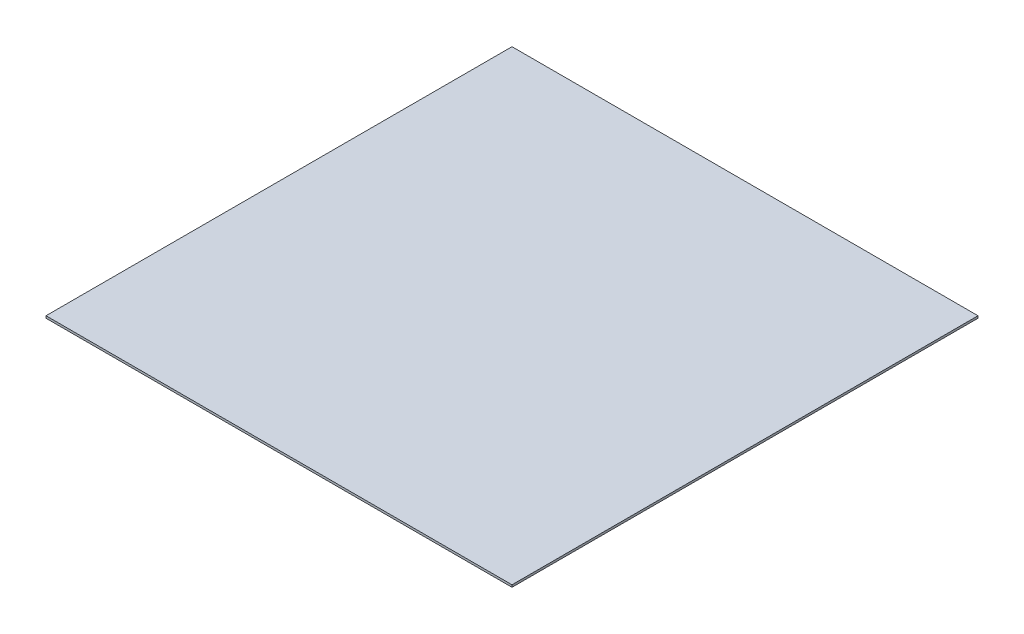
from build123d import *

# Parameters (mm, degrees)
SKETCH1_W           = 1486
SKETCH1_H           = 1486
BOSS_EXTRUDE1_DEPTH = 7


with BuildPart() as part:
    # Sketch1 → Boss-Extrude1 (new body)
    with BuildSketch(Plane(origin=(0, 0, 0), x_dir=(1, 0, 0), z_dir=(0, 1, 0))):
        Rectangle(SKETCH1_W, SKETCH1_H)
    extrude(amount=BOSS_EXTRUDE1_DEPTH)


solid = part.part
